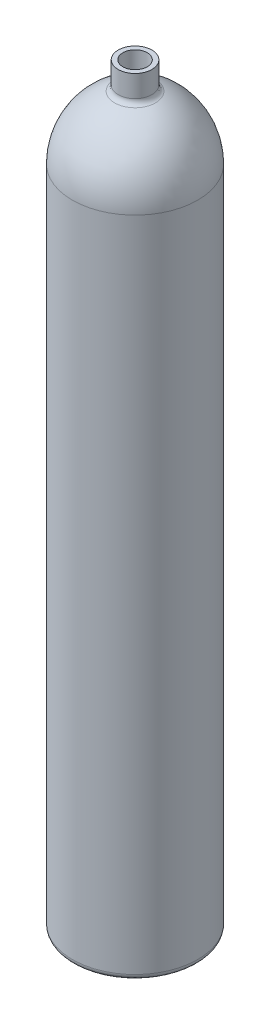
from build123d import *

# Parameters (mm, degrees)
SKETCH1_R           = 53.975
SKETCH1_R_2         = 49.975
BOSS_EXTRUDE1_DEPTH = 283.75
SKETCH2_R           = 53.975
BOSS_EXTRUDE2_DEPTH = 4
FILLET1_R           = 5


with BuildPart() as part:
    # Sketch1 → Boss-Extrude1 (new, symmetric)
    with BuildSketch(Plane(origin=(0, 0, 0), x_dir=(1, 0, 0), z_dir=(0, 1, 0))):
        with Locations(Location((0, 0, 0), (0, 0, 270))):
            Circle(SKETCH1_R)
        with Locations(Location((0, 0, 0), (0, 0, 270))):
            Circle(SKETCH1_R_2, mode=Mode.SUBTRACT)
    extrude(amount=BOSS_EXTRUDE1_DEPTH, both=True)

    # Sketch2 → Boss-Extrude2 (add)
    with BuildSketch(Plane.XZ.offset(283.75)):
        with Locations(Location((0, 0, 0), (0, 0, 270))):
            Circle(SKETCH2_R)
    extrude(amount=BOSS_EXTRUDE2_DEPTH)

    # Sketch3 → Revolve1 (revolve)
    with BuildSketch(Plane.XY, mode=Mode.PRIVATE) as revolve1_sk:
        with BuildLine():
            Line((-14.520190182, 339.3125), (-14.520190182, 361.5375))
            Line((-14.520190182, 361.5375), (-10.520190182, 361.5375))
            Line((-10.520190182, 361.5375), (-10.520190182, 336.395540435))
            ThreePointArc((-10.520190182, 336.395540435), (-39.016633765, 316.644661214), (-49.975, 283.75))
            Line((-49.975, 283.75), (-53.975, 283.75))
            ThreePointArc((-53.975, 283.75), (-43.107974032, 317.822985722), (-14.520190182, 339.3125))
        make_face()
    revolve(revolve1_sk.sketch.rotate(Axis((0, 0, 0), (0, 1, 0)), 270), axis=Axis((0, 0, 0), (0, 1, 0)))

    # Fillet1
    fillet1_edges = [part.edges().sort_by_distance(p)[0] for p in [
        (0, -287.75, 53.975),
        (0, 339.3125, 14.520190182),
        (0, -283.75, -49.975),
    ]]
    fillet(fillet1_edges, radius=FILLET1_R)


solid = part.part
